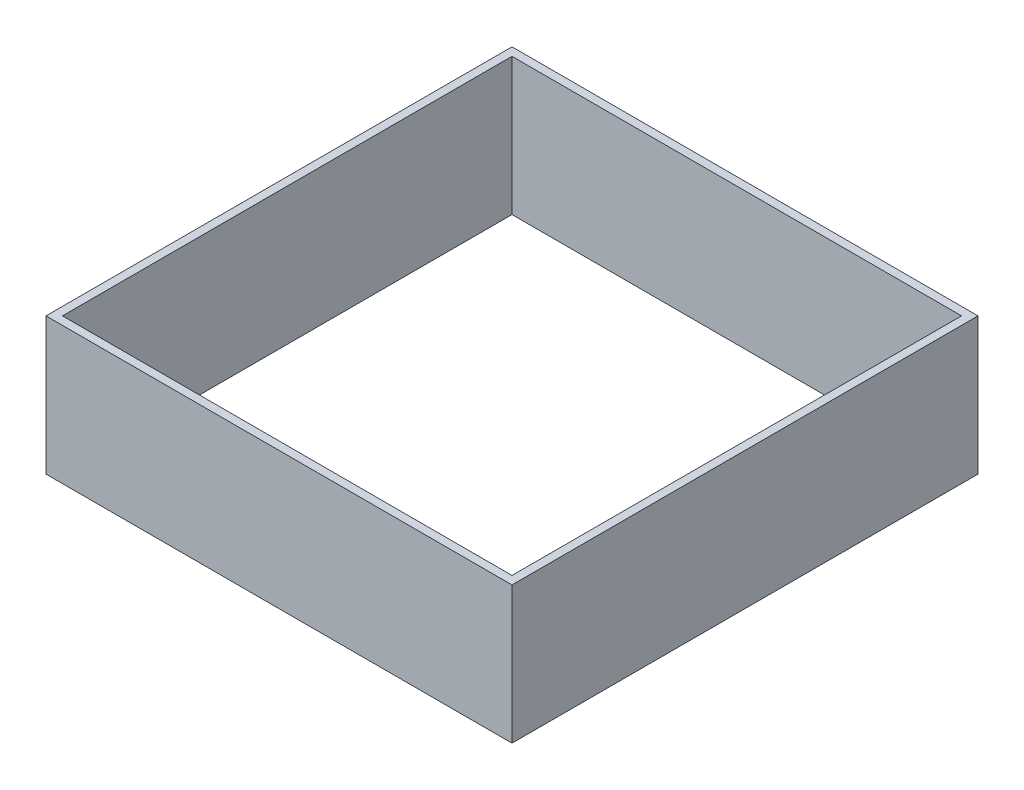
from build123d import *

# Parameters (mm, degrees)
SKETCH1_W           = 340
SKETCH1_H           = 340
SKETCH1_W_2         = 328
SKETCH1_H_2         = 328
BOSS_EXTRUDE1_DEPTH = 100


with BuildPart() as part:
    # Sketch1 → Boss-Extrude1 (new body)
    with BuildSketch(Plane(origin=(0, 0, 0), x_dir=(1, 0, 0), z_dir=(0, 1, 0))):
        Rectangle(SKETCH1_W, SKETCH1_H)
        Rectangle(SKETCH1_W_2, SKETCH1_H_2, mode=Mode.SUBTRACT)
    extrude(amount=BOSS_EXTRUDE1_DEPTH)


solid = part.part
